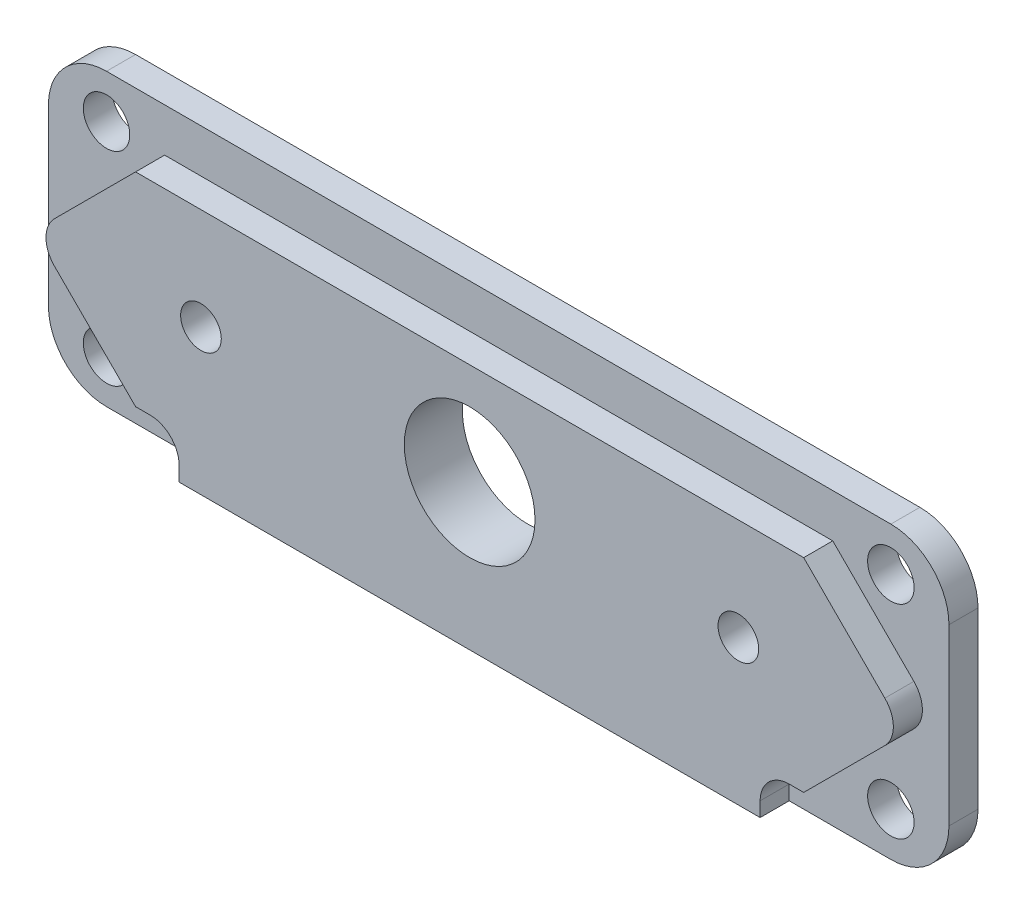
from build123d import *

# Parameters (mm, degrees)
BOSS_EXTRUDE1_DEPTH = 2
BOSS_EXTRUDE2_DEPTH = 2
CUT_EXTRUDE1_REACH  = 34.818
SKETCH4_R           = 4.5
SKETCH4_R_2         = 1.4
CUT_EXTRUDE2_REACH  = 34.818
SKETCH5_R           = 1.6


with BuildPart() as part:
    # Sketch2 → Boss-Extrude1 (new body)
    with BuildSketch(Plane.XY):
        with BuildLine():
            Line((-27, -10), (27, -10))
            ThreePointArc((27, -10), (29.828427125, -8.828427125), (31, -6))
            Line((31, -6), (31, 6))
            ThreePointArc((31, 6), (29.828427125, 8.828427125), (27, 10))
            Line((27, 10), (-27, 10))
            ThreePointArc((-27, 10), (-29.828427125, 8.828427125), (-31, 6))
            Line((-31, 6), (-31, -6))
            ThreePointArc((-31, -6), (-29.828427125, -8.828427125), (-27, -10))
        make_face()
    extrude(amount=BOSS_EXTRUDE1_DEPTH)

    # Sketch3 → Boss-Extrude2 (add)
    with BuildSketch(Plane.XY.offset(2)):
        with BuildLine():
            Line((-28.585786438, 1.414213562), (-23, 7))
            Line((-23, 7), (23, 7))
            Line((23, 7), (28.585786438, 1.414213562))
            ThreePointArc((28.585786438, 1.414213562), (29.171572875, 0), (28.585786438, -1.414213562))
            Line((28.585786438, -1.414213562), (23, -7))
            Line((23, -7), (22, -7))
            ThreePointArc((22, -7), (20.585786438, -7.585786438), (20, -9))
            Line((20, -9), (20, -10))
            Line((20, -10), (-20, -10))
            Line((-20, -10), (-20, -9))
            ThreePointArc((-20, -9), (-20.585786438, -7.585786438), (-22, -7))
            Line((-22, -7), (-23, -7))
            Line((-23, -7), (-28.585786438, -1.414213562))
            ThreePointArc((-28.585786438, -1.414213562), (-29.171572875, 0), (-28.585786438, 1.414213562))
        make_face()
    extrude(amount=BOSS_EXTRUDE2_DEPTH)

    # Sketch4 → Cut-Extrude1 (cut, up to next)
    with BuildSketch(Plane(origin=(0, 0, 0), x_dir=(-1, 0, 0), z_dir=(0, 0, -1)), mode=Mode.PRIVATE) as cut_extrude1_sk1:
        Circle(SKETCH4_R)
    cut_extrude1_tool1 = extrude(cut_extrude1_sk1.sketch, amount=-CUT_EXTRUDE1_REACH, mode=Mode.PRIVATE) & part.part
    # Sketch4 → Cut-Extrude1 (cut, up to next)
    with BuildSketch(Plane(origin=(0, 0, 0), x_dir=(-1, 0, 0), z_dir=(0, 0, -1)), mode=Mode.PRIVATE) as cut_extrude1_sk2:
        with Locations((-18.5, 0)):
            Circle(SKETCH4_R_2)
    cut_extrude1_tool2 = extrude(cut_extrude1_sk2.sketch, amount=-CUT_EXTRUDE1_REACH, mode=Mode.PRIVATE) & part.part
    # Sketch4 → Cut-Extrude1 (cut, up to next)
    with BuildSketch(Plane(origin=(0, 0, 0), x_dir=(-1, 0, 0), z_dir=(0, 0, -1)), mode=Mode.PRIVATE) as cut_extrude1_sk3:
        with Locations(Location((18.5, 0, 0), (0, 0, 180))):
            Circle(SKETCH4_R_2)
    cut_extrude1_tool3 = extrude(cut_extrude1_sk3.sketch, amount=-CUT_EXTRUDE1_REACH, mode=Mode.PRIVATE) & part.part
    add(cut_extrude1_tool1.solids().sort_by_distance((0, 0, 0))[0], mode=Mode.SUBTRACT)
    add(cut_extrude1_tool2.solids().sort_by_distance((18.5, 0, 0))[0], mode=Mode.SUBTRACT)
    add(cut_extrude1_tool3.solids().sort_by_distance((-18.5, 0, 0))[0], mode=Mode.SUBTRACT)

    # Sketch5 → Cut-Extrude2 (cut, up to next)
    with BuildSketch(Plane(origin=(0, 0, 0), x_dir=(-1, 0, 0), z_dir=(0, 0, -1)), mode=Mode.PRIVATE) as cut_extrude2_sk1:
        with Locations((-27, 7)):
            Circle(SKETCH5_R)
    cut_extrude2_tool1 = extrude(cut_extrude2_sk1.sketch, amount=-CUT_EXTRUDE2_REACH, mode=Mode.PRIVATE) & part.part
    # Sketch5 → Cut-Extrude2 (cut, up to next)
    with BuildSketch(Plane(origin=(0, 0, 0), x_dir=(-1, 0, 0), z_dir=(0, 0, -1)), mode=Mode.PRIVATE) as cut_extrude2_sk2:
        with Locations((27, 7)):
            Circle(SKETCH5_R)
    cut_extrude2_tool2 = extrude(cut_extrude2_sk2.sketch, amount=-CUT_EXTRUDE2_REACH, mode=Mode.PRIVATE) & part.part
    # Sketch5 → Cut-Extrude2 (cut, up to next)
    with BuildSketch(Plane(origin=(0, 0, 0), x_dir=(-1, 0, 0), z_dir=(0, 0, -1)), mode=Mode.PRIVATE) as cut_extrude2_sk3:
        with Locations((27, -7)):
            Circle(SKETCH5_R)
    cut_extrude2_tool3 = extrude(cut_extrude2_sk3.sketch, amount=-CUT_EXTRUDE2_REACH, mode=Mode.PRIVATE) & part.part
    # Sketch5 → Cut-Extrude2 (cut, up to next)
    with BuildSketch(Plane(origin=(0, 0, 0), x_dir=(-1, 0, 0), z_dir=(0, 0, -1)), mode=Mode.PRIVATE) as cut_extrude2_sk4:
        with Locations((-27, -7)):
            Circle(SKETCH5_R)
    cut_extrude2_tool4 = extrude(cut_extrude2_sk4.sketch, amount=-CUT_EXTRUDE2_REACH, mode=Mode.PRIVATE) & part.part
    add(cut_extrude2_tool1.solids().sort_by_distance((27, 7, 0))[0], mode=Mode.SUBTRACT)
    add(cut_extrude2_tool2.solids().sort_by_distance((-27, 7, 0))[0], mode=Mode.SUBTRACT)
    add(cut_extrude2_tool3.solids().sort_by_distance((-27, -7, 0))[0], mode=Mode.SUBTRACT)
    add(cut_extrude2_tool4.solids().sort_by_distance((27, -7, 0))[0], mode=Mode.SUBTRACT)


solid = part.part
